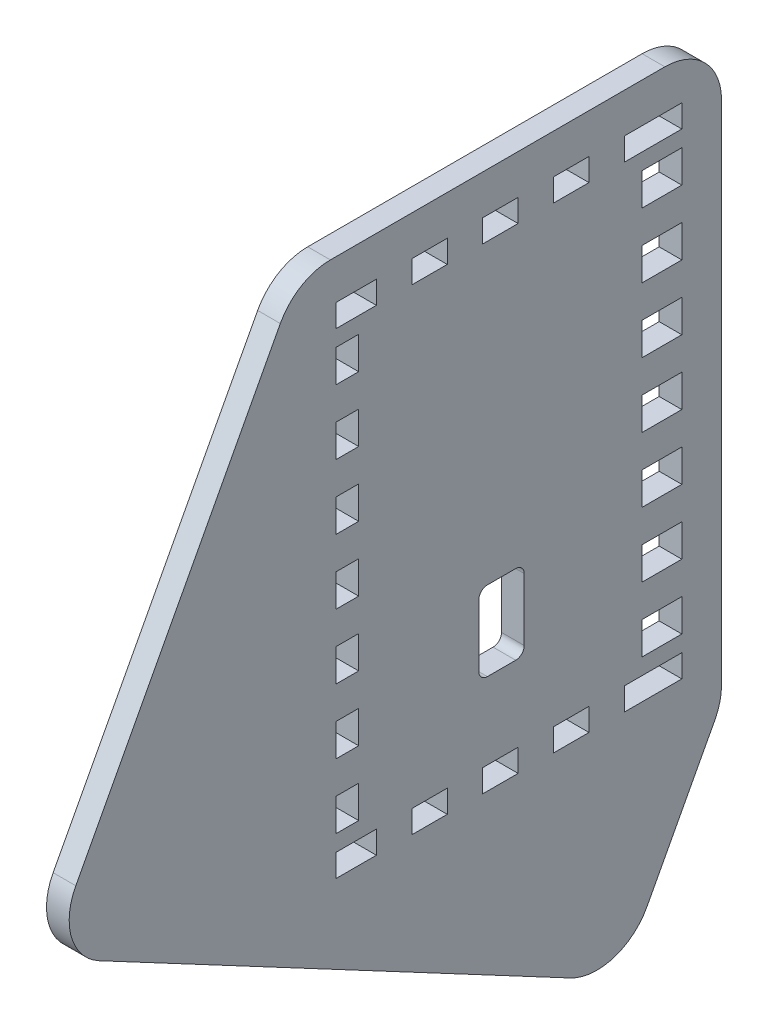
from build123d import *

# Parameters (mm, degrees)
SCHIZZO1_W                    = 50
SCHIZZO1_H                    = 80
ESTRUSIONE_ESTRUSIONE1_DEPTH  = 4
SCHIZZO2_W                    = 4
SCHIZZO2_H                    = 2.857142857
SCHIZZO2_W_2                  = 7
ESTRUSIONE_ESTRUSIONE2_DEPTH  = 4
SCHIZZO3_W                    = 4
SCHIZZO3_H                    = 5.714285715
SCHIZZO3_W_2                  = 7
ESTRUSIONE_ESTRUSIONE3_DEPTH  = 4
RIPETIZIONE_A_L1_COUNT        = 6
RIPETIZIONE_A_L1_PITCH        = 11.428571
SCHIZZO4_W                    = 6.25
SCHIZZO4_H                    = 4
ESTRUSIONE_ESTRUSIONE4_DEPTH  = 4
RIPETIZIONE_A_L2_COUNT        = 4
RIPETIZIONE_A_L2_PITCH        = 12.5
SCHIZZO5_W                    = 61
SCHIZZO5_H                    = 88
ESTRUSIONE_ESTRUSIONE5_DEPTH  = 4
RACCORDO1_R                   = 10
TAGLIO_ESTRUSIONE1_DEPTH      = 112.323851892
TAGLIO_ESTRUSIONE1_DEPTH_BACK = 112.323851892
RACCORDO2_R                   = 10


with BuildPart() as part:
    # Schizzo1 → Estrusione-Estrusione1 (new body)
    with BuildSketch(Plane(origin=(0, 0, 0), x_dir=(0, 0, -1), z_dir=(1, 0, 0))):
        with Locations((25, 40)):
            Rectangle(SCHIZZO1_W, SCHIZZO1_H)
    extrude(amount=ESTRUSIONE_ESTRUSIONE1_DEPTH)

    # Schizzo2 → Estrusione-Estrusione2 (add)
    with BuildSketch(Plane(origin=(4, 0, 0), x_dir=(0, 0, -1), z_dir=(1, 0, 0))):
        with Locations((-2, 78.571428572)):
            Rectangle(SCHIZZO2_W, SCHIZZO2_H)
        with Locations((53.5, 78.571428572)):
            Rectangle(SCHIZZO2_W_2, SCHIZZO2_H)
        with Locations((53.5, 1.428571429)):
            Rectangle(SCHIZZO2_W_2, SCHIZZO2_H)
        with Locations((-2, 1.428571429)):
            Rectangle(SCHIZZO2_W, SCHIZZO2_H)
    extrude(amount=-ESTRUSIONE_ESTRUSIONE2_DEPTH)

    # Schizzo3 → Estrusione-Estrusione3 (add)
    with BuildSketch(Plane(origin=(4, 0, 0), x_dir=(0, 0, -1), z_dir=(1, 0, 0))):
        with Locations((-2, 68.571428572)):
            Rectangle(SCHIZZO3_W, SCHIZZO3_H)
        with Locations((53.5, 68.571428572)):
            Rectangle(SCHIZZO3_W_2, SCHIZZO3_H)
    estrusione_estrusione3 = extrude(amount=-ESTRUSIONE_ESTRUSIONE3_DEPTH)

    # Ripetizione a L1: Estrusione-Estrusione3 ×6
    with Locations(*[(0, -i * RIPETIZIONE_A_L1_PITCH, 0) for i in range(1, RIPETIZIONE_A_L1_COUNT)]):
        add(estrusione_estrusione3)

    # Schizzo4 → Estrusione-Estrusione4 (add)
    with BuildSketch(Plane(origin=(4, 0, 0), x_dir=(0, 0, -1), z_dir=(1, 0, 0))):
        with Locations((6.25, 82)):
            Rectangle(SCHIZZO4_W, SCHIZZO4_H)
        with Locations((6.25, -2)):
            Rectangle(SCHIZZO4_W, SCHIZZO4_H)
    estrusione_estrusione4 = extrude(amount=-ESTRUSIONE_ESTRUSIONE4_DEPTH)

    # Ripetizione a L2: Estrusione-Estrusione4 ×4
    with Locations(*[(0, 0, -i * RIPETIZIONE_A_L2_PITCH) for i in range(1, RIPETIZIONE_A_L2_COUNT)]):
        add(estrusione_estrusione4)

    # Schizzo5 → Estrusione-Estrusione5 (add)
    with BuildSketch(Plane(origin=(4, 0, 0), x_dir=(0, 0, -1), z_dir=(1, 0, 0))):
        Polygon((64, -11), (46.160080614, -44.552008529), (-54.590569466, 9.018062365), (-11, 91), (64, 91), align=None)
        with Locations((26.5, 40)):
            Rectangle(SCHIZZO5_W, SCHIZZO5_H, mode=Mode.SUBTRACT)
    extrude(amount=-ESTRUSIONE_ESTRUSIONE5_DEPTH)

    # Raccordo1
    raccordo1_edges = [part.edges().sort_by_distance(p)[0] for p in [
        (2, -44.552008529, -46.160080614),
        (2, 9.018062365, 54.590569466),
    ]]
    fillet(raccordo1_edges, radius=RACCORDO1_R)

    # Schizzo6 → Taglio-Estrusione1 (cut, two sides: drawn at the far end of the back side and taken through both)
    with BuildSketch(Plane(origin=(4, 0, 0), x_dir=(0, 0, -1), z_dir=(1, 0, 0)).offset(-TAGLIO_ESTRUSIONE1_DEPTH_BACK)):
        with BuildLine():
            Line((21.2, 26), (21.2, 15))
            ThreePointArc((21.2, 15), (21.639339828, 13.939339828), (22.7, 13.5))
            Line((22.7, 13.5), (27.7, 13.5))
            ThreePointArc((27.7, 13.5), (28.760660172, 13.939339828), (29.2, 15))
            Line((29.2, 15), (29.2, 26))
            ThreePointArc((29.2, 26), (28.760660172, 27.060660172), (27.7, 27.5))
            Line((27.7, 27.5), (22.7, 27.5))
            ThreePointArc((22.7, 27.5), (21.639339828, 27.060660172), (21.2, 26))
        make_face()
    extrude(amount=TAGLIO_ESTRUSIONE1_DEPTH + TAGLIO_ESTRUSIONE1_DEPTH_BACK, mode=Mode.SUBTRACT)

    # Raccordo2
    raccordo2_edges = [part.edges().sort_by_distance(p)[0] for p in [
        (2, 91, -64),
        (2, -11, -64),
        (2, 91, 11),
    ]]
    fillet(raccordo2_edges, radius=RACCORDO2_R)


solid = part.part
